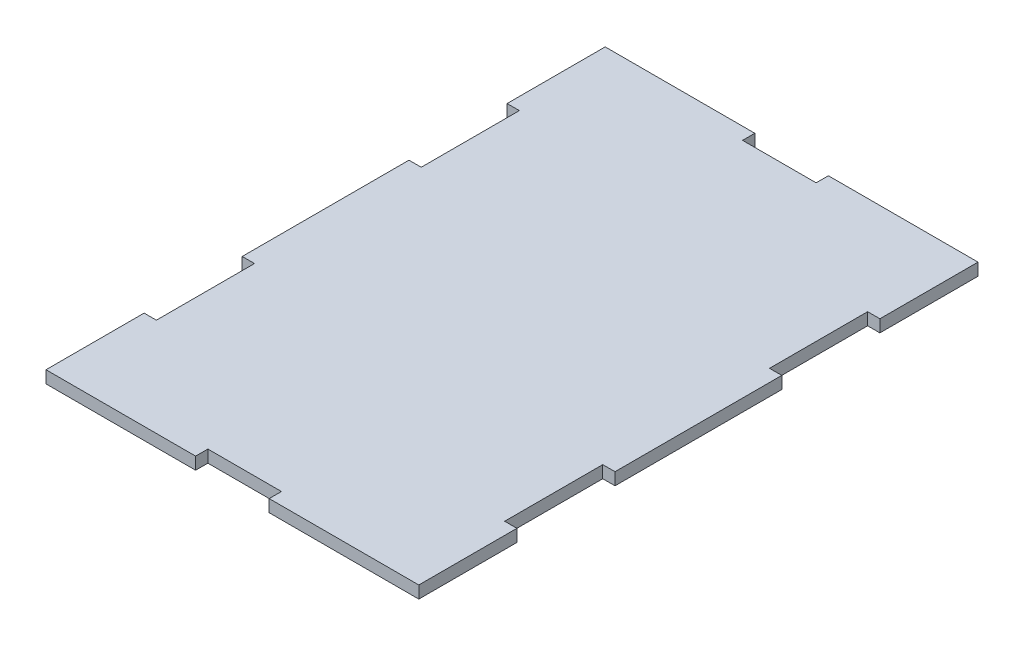
from build123d import *

# Parameters (mm, degrees)
BOSS_EXTRUDE1_DEPTH = 3.175


with BuildPart() as part:
    # Sketch1 → Boss-Extrude1 (new body)
    with BuildSketch(Plane(origin=(0, 0, 0), x_dir=(1, 0, 0), z_dir=(0, 1, 0))):
        Polygon((38.735, 144.78), (38.735, 141.605), (57.785, 141.605), (57.785, 144.78), (96.52, 144.78), (96.52, 119.38), (93.345, 119.38), (93.345, 93.98), (96.52, 93.98), (96.52, 50.8), (93.345, 50.8), (93.345, 25.4), (96.52, 25.4), (96.52, 0), (57.785, 0), (57.785, 3.175), (38.735, 3.175), (38.735, 0), (0, 0), (0, 25.4), (3.175, 25.4), (3.175, 50.8), (0, 50.8), (0, 93.98), (3.175, 93.98), (3.175, 119.38), (0, 119.38), (0, 144.78), align=None)
    extrude(amount=BOSS_EXTRUDE1_DEPTH)


solid = part.part
